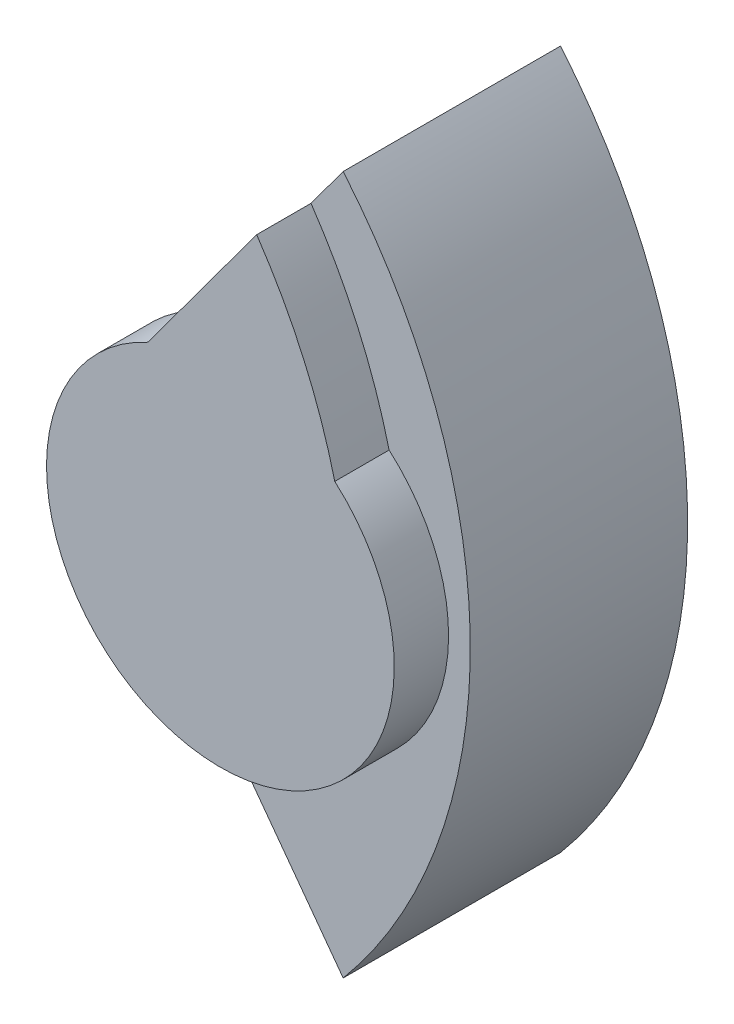
from build123d import *

# Parameters (mm, degrees)
SKETCH3_R           = 14
BOSS_EXTRUDE1_DEPTH = 5
BOSS_EXTRUDE2_START = -3
BOSS_EXTRUDE2_DEPTH = 3
BOSS_EXTRUDE3_START = -20
BOSS_EXTRUDE3_DEPTH = 20
BOSS_EXTRUDE4_START = -20
SKETCH3_5_R         = 14
BOSS_EXTRUDE4_DEPTH = 20
BOSS_EXTRUDE5_DEPTH = 5


with BuildPart() as part:
    # Sketch3 → Boss-Extrude1 (new body)
    with BuildSketch(Plane.XY):
        with Locations((32, 0)):
            Circle(SKETCH3_R)
    extrude(amount=BOSS_EXTRUDE1_DEPTH)

    # Sketch3<3> → Boss-Extrude2 (add)
    with BuildSketch(Plane.XY.offset(BOSS_EXTRUDE2_START)):
        with BuildLine():
            ThreePointArc((38.302222156, -32.139380484), (50, 0), (38.302222156, 32.139380484))
            Line((38.302222156, 32.139380484), (20.731628295, 8.308056278))
            ThreePointArc((20.731628295, 8.308056278), (18, 0), (20.731628295, -8.308056278))
            Line((20.731628295, -8.308056278), (38.302222156, -32.139380484))
        make_face()
    extrude(amount=BOSS_EXTRUDE2_DEPTH)

    # Sketch3<4> → Boss-Extrude3 (add)
    with BuildSketch(Plane.XY.offset(BOSS_EXTRUDE3_START)):
        with BuildLine():
            ThreePointArc((38.302222156, -32.139380484), (50, 0), (38.302222156, 32.139380484))
            Line((38.302222156, 32.139380484), (37.349918698, 30.84775354))
            ThreePointArc((37.349918698, 30.84775354), (48, 0), (37.349918698, -30.84775354))
            Line((37.349918698, -30.84775354), (38.302222156, -32.139380484))
        make_face()
    extrude(amount=BOSS_EXTRUDE3_DEPTH)

    # Sketch3<5> → Boss-Extrude4 (add)
    with BuildSketch(Plane.XY.offset(BOSS_EXTRUDE4_START)):
        with Locations((32, 0)):
            Circle(SKETCH3_5_R)
    extrude(amount=BOSS_EXTRUDE4_DEPTH)

    # Sketch4 → Boss-Extrude5 (add)
    with BuildSketch(Plane.XY):
        with BuildLine():
            ThreePointArc((42.526315789, 12.049758334), (39.646765333, 20.405215379), (35.341109992, 28.123168822))
            Line((35.341109992, 28.123168822), (25.328337382, 14.542658557))
            ThreePointArc((25.328337382, 14.542658557), (29.704738436, -15.834512129), (42.526315789, 12.049758334))
        make_face()
    extrude(amount=BOSS_EXTRUDE5_DEPTH)


solid = part.part
